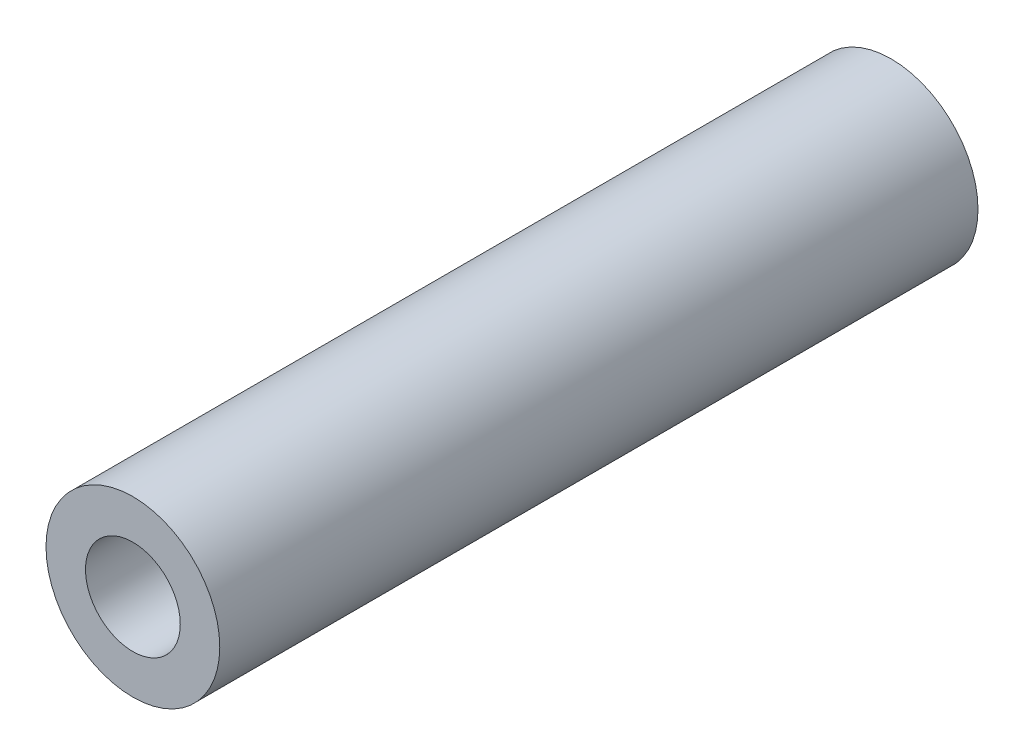
from build123d import *

# Parameters (mm, degrees)
SWEEP1_PROFILE_R     = 8.73125
CUT_SWEEP1_PROFILE_R = 4.7625


with BuildPart() as part:
    # Sweep1: sweep along a curve in space
    with BuildLine() as sweep1_path:
        Line((0, 0, 0), (0, 0, 76.2))
    # Sweep1 profile (on start of the path) → Sweep1 (sweep)
    with BuildSketch(Plane.XY):
        Circle(SWEEP1_PROFILE_R)
    sweep(path=sweep1_path.line)

    # Cut-Sweep1: sweep along a curve in space
    with BuildLine() as cut_sweep1_path:
        Line((0, 0, 0), (0, 0, 76.2))
    # Cut-Sweep1 profile (on start of the path) → Cut-Sweep1 (sweep, cut)
    with BuildSketch(Plane.XY):
        Circle(CUT_SWEEP1_PROFILE_R)
    sweep(path=cut_sweep1_path.line, mode=Mode.SUBTRACT)


solid = part.part
